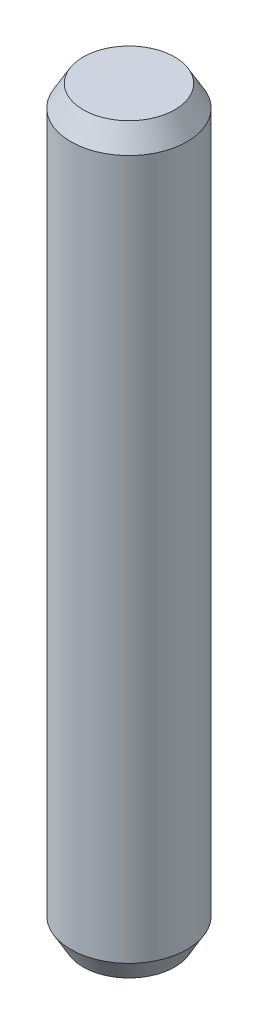
from build123d import *

# Parameters (mm, degrees)
SKETCH1_R           = 4.7
BOSS_EXTRUDE1_DEPTH = 60
CHAMFER1_SIZE       = 1
CHAMFER1_SIZE2      = 1.732050808
CHAMFER3_SIZE       = 1
CHAMFER3_SIZE2      = 1.732050808


with BuildPart() as part:
    # Sketch1 → Boss-Extrude1 (new body)
    with BuildSketch(Plane(origin=(0, 0, 0), x_dir=(1, 0, 0), z_dir=(0, 1, 0))):
        with Locations(Location((0, 0, 0), (0, 0, 270))):
            Circle(SKETCH1_R)
    extrude(amount=BOSS_EXTRUDE1_DEPTH)

    # Chamfer1
    chamfer1_edges = [part.edges().sort_by_distance(p)[0] for p in [
        (0, 0, -4.7),
    ]]
    chamfer1_side = [part.faces().sort_by_distance(p)[0] for p in [
        (0, 0, 0),
    ]]
    chamfer(chamfer1_edges, length=CHAMFER1_SIZE, length2=CHAMFER1_SIZE2, reference=chamfer1_side[0])

    # Chamfer3
    chamfer3_edges = [part.edges().sort_by_distance(p)[0] for p in [
        (0, 60, -4.7),
    ]]
    chamfer3_side = [part.faces().sort_by_distance(p)[0] for p in [
        (0, 60, 0),
    ]]
    chamfer(chamfer3_edges, length=CHAMFER3_SIZE, length2=CHAMFER3_SIZE2, reference=chamfer3_side[0])


solid = part.part
